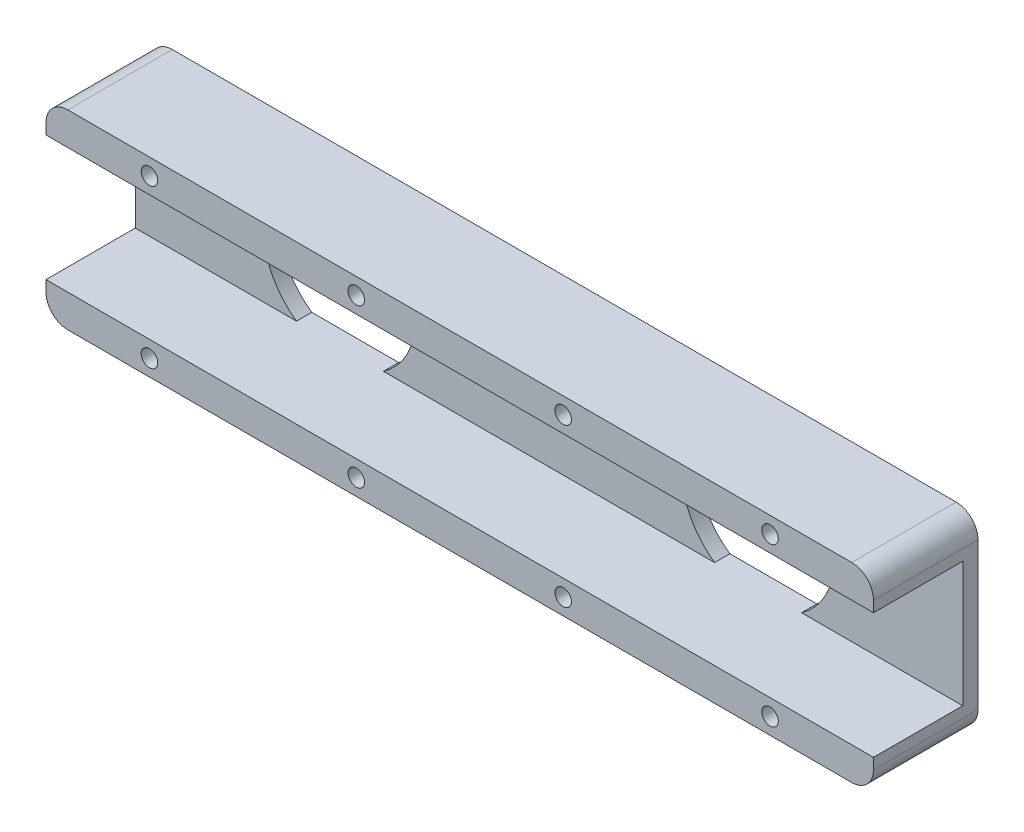
from build123d import *

# Parameters (mm, degrees)
BOSS_EXTRUDE4_DEPTH                            = 3.5
SKETCH6_W                                      = 190
SKETCH6_H                                      = 7.5
BOSS_EXTRUDE5_DEPTH                            = 20.5
CSK_FOR_6_FLAT_HEAD_MACHINE_SCREW1_D           = 3.7973
CSK_FOR_6_FLAT_HEAD_MACHINE_SCREW1_CSINK_D     = 7.0866
CSK_FOR_6_FLAT_HEAD_MACHINE_SCREW1_CSINK_ANGLE = 82
FILLET1_R                                      = 5


with BuildPart() as part:
    # Sketch5 → Boss-Extrude4 (new body)
    with BuildSketch(Plane.XY):
        Polygon((95, 21.875), (95, 14.375), (95, -14.375), (95, -21.875), (-95, -21.875), (-95, -14.375), (-95, 14.375), (-95, 21.875), align=None)
        with BuildLine():
            Line((57.980449639, 14.375), (38.019550361, 14.375))
            ThreePointArc((38.019550361, 14.375), (30.5, 0), (38.019550361, -14.375))
            Line((38.019550361, -14.375), (57.980449639, -14.375))
            ThreePointArc((57.980449639, -14.375), (65.5, 0), (57.980449639, 14.375))
        make_face(mode=Mode.SUBTRACT)
        with BuildLine():
            Line((-57.980449639, -14.375), (-38.019550361, -14.375))
            ThreePointArc((-38.019550361, -14.375), (-30.5, 0), (-38.019550361, 14.375))
            Line((-38.019550361, 14.375), (-57.980449639, 14.375))
            ThreePointArc((-57.980449639, 14.375), (-65.5, 0), (-57.980449639, -14.375))
        make_face(mode=Mode.SUBTRACT)
    extrude(amount=BOSS_EXTRUDE4_DEPTH)

    # Sketch6 → Boss-Extrude5 (add)
    with BuildSketch(Plane.XY.offset(3.5)):
        with Locations((0, 18.125)):
            Rectangle(SKETCH6_W, SKETCH6_H)
        with Locations((0, -18.125)):
            Rectangle(SKETCH6_W, SKETCH6_H)
    extrude(amount=BOSS_EXTRUDE5_DEPTH)

    # CSK for #6 Flat Head Machine Screw1 (through all)
    with Locations(Plane(origin=(0, 0, 0), x_dir=(-1, 0, 0), z_dir=(0, 0, -1))):
        with Locations((71.25, 18.125), (23.75, 18.125), (-23.75, 18.125), (-71.25, 18.125), (71.25, -18.125), (23.75, -18.125), (-23.75, -18.125), (-71.25, -18.125)):
            CounterSinkHole(CSK_FOR_6_FLAT_HEAD_MACHINE_SCREW1_D / 2, CSK_FOR_6_FLAT_HEAD_MACHINE_SCREW1_CSINK_D / 2, counter_sink_angle=CSK_FOR_6_FLAT_HEAD_MACHINE_SCREW1_CSINK_ANGLE)

    # Fillet1
    fillet1_edges = [part.edges().sort_by_distance(p)[0] for p in [
        (95, 21.875, 12),
        (95, -21.875, 12),
        (-95, -21.875, 12),
        (-95, 21.875, 12),
    ]]
    fillet(fillet1_edges, radius=FILLET1_R)


solid = part.part
